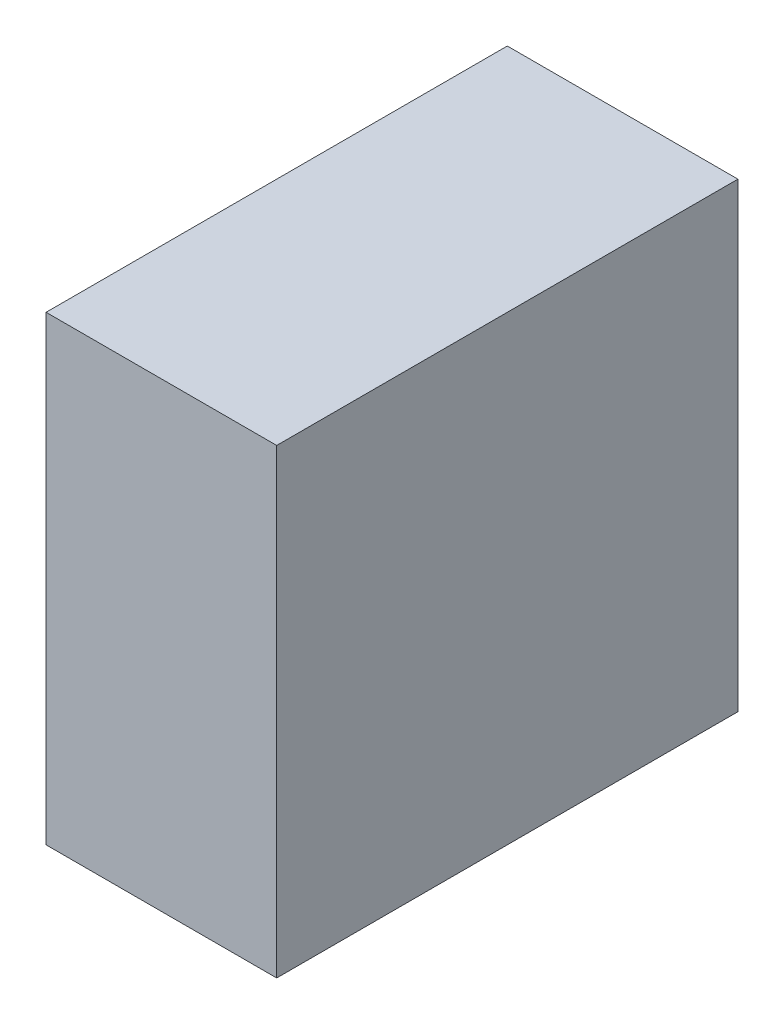
from build123d import *

# Parameters (mm, degrees)
MTG_ENKODER_KAPAGI_1_START = 15
SKETCH1_W                  = 15
SKETCH1_H                  = 30
MTG_ENKODER_KAPAGI_1_DEPTH = 30


with BuildPart() as part:
    # Sketch1 → MTG_enkoder_kapagi_1 (new body)
    with BuildSketch(Plane.XY.offset(MTG_ENKODER_KAPAGI_1_START)):
        with Locations((135.5, 0)):
            Rectangle(SKETCH1_W, SKETCH1_H)
    extrude(amount=-MTG_ENKODER_KAPAGI_1_DEPTH)


solid = part.part
